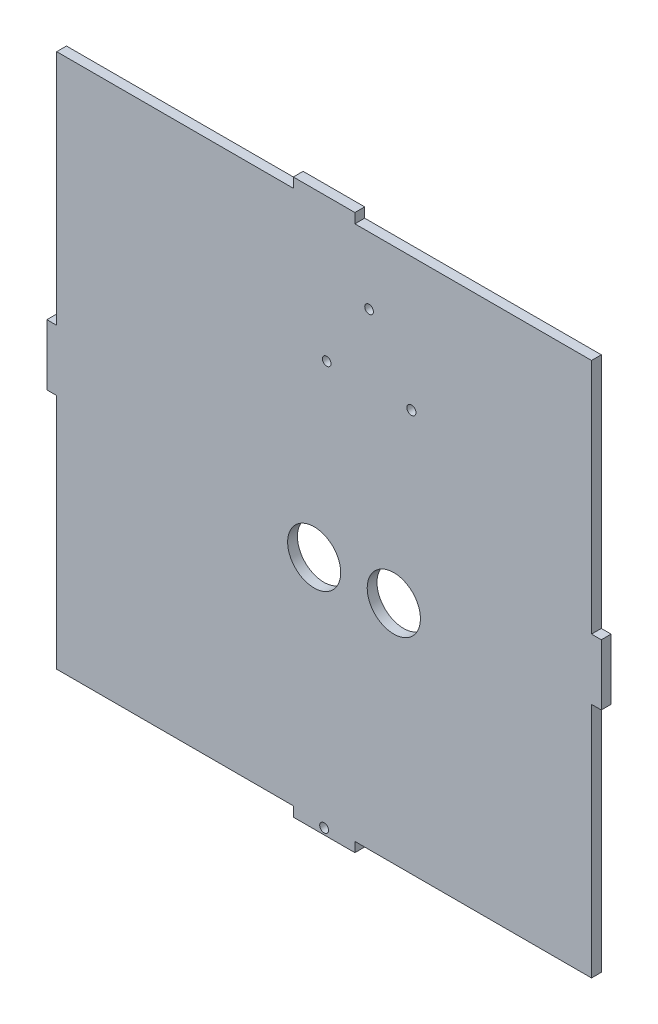
from build123d import *

# Parameters (mm, degrees)
SKETCH3_W           = 180
SKETCH3_H           = 180
SKETCH3_R           = 8.616960002
SKETCH3_R_2         = 8.643887018
SKETCH3_R_3         = 1.43602308
SKETCH3_R_4         = 1.4
SKETCH3_R_5         = 1.467212263
BOSS_EXTRUDE1_DEPTH = 3.18
SKETCH4_W           = 80
SKETCH4_H           = 3.18
CUT_EXTRUDE1_DEPTH  = 128.318939675
SKETCH5_W           = 3.18
SKETCH5_H           = 80.125
CUT_EXTRUDE2_DEPTH  = 128.318939675


with BuildPart() as part:
    # Sketch3 → Boss-Extrude1 (new body)
    with BuildSketch(Plane.XY):
        Rectangle(SKETCH3_W, SKETCH3_H)
        with Locations(Location((-3.22889268, -13.57556396, 0), (0, 0, 180))):
            Circle(SKETCH3_R, mode=Mode.SUBTRACT)
        with Locations(Location((22.63110732, -13.57556396, 0), (0, 0, 180))):
            Circle(SKETCH3_R_2, mode=Mode.SUBTRACT)
        with Locations(Location((0, -88, 0), (0, 0, 180))):
            Circle(SKETCH3_R_3, mode=Mode.SUBTRACT)
        with Locations(Location((0.844873764, 43.606084924, 0), (0, 0, 180))):
            Circle(SKETCH3_R_4, mode=Mode.SUBTRACT)
        with Locations(Location((14.594873764, 65.106084924, 0), (0, 0, 180))):
            Circle(SKETCH3_R_4, mode=Mode.SUBTRACT)
        with Locations(Location((28.344873764, 43.606084924, 0), (0, 0, 180))):
            Circle(SKETCH3_R_5, mode=Mode.SUBTRACT)
    extrude(amount=BOSS_EXTRUDE1_DEPTH)

    # Sketch4 → Cut-Extrude1 (cut, through all)
    with BuildSketch(Plane.XY.offset(3.18)):
        with Locations((50, -88.41)):
            Rectangle(SKETCH4_W, SKETCH4_H)
        with Locations((-50, 88.41)):
            Rectangle(SKETCH4_W, SKETCH4_H)
        with Locations((50, 88.41)):
            Rectangle(SKETCH4_W, SKETCH4_H)
        with Locations((-50, -88.41)):
            Rectangle(SKETCH4_W, SKETCH4_H)
    extrude(amount=-CUT_EXTRUDE1_DEPTH, mode=Mode.SUBTRACT)

    # Sketch5 → Cut-Extrude2 (cut, through all)
    with BuildSketch(Plane.XY.offset(3.18)):
        with Locations((-88.41, 49.9375)):
            Rectangle(SKETCH5_W, SKETCH5_H)
        with Locations((-88.41, -49.9375)):
            Rectangle(SKETCH5_W, SKETCH5_H)
        with Locations((88.41, -49.9375)):
            Rectangle(SKETCH5_W, SKETCH5_H)
        with Locations((88.41, 49.9375)):
            Rectangle(SKETCH5_W, SKETCH5_H)
    extrude(amount=-CUT_EXTRUDE2_DEPTH, mode=Mode.SUBTRACT)


solid = part.part
